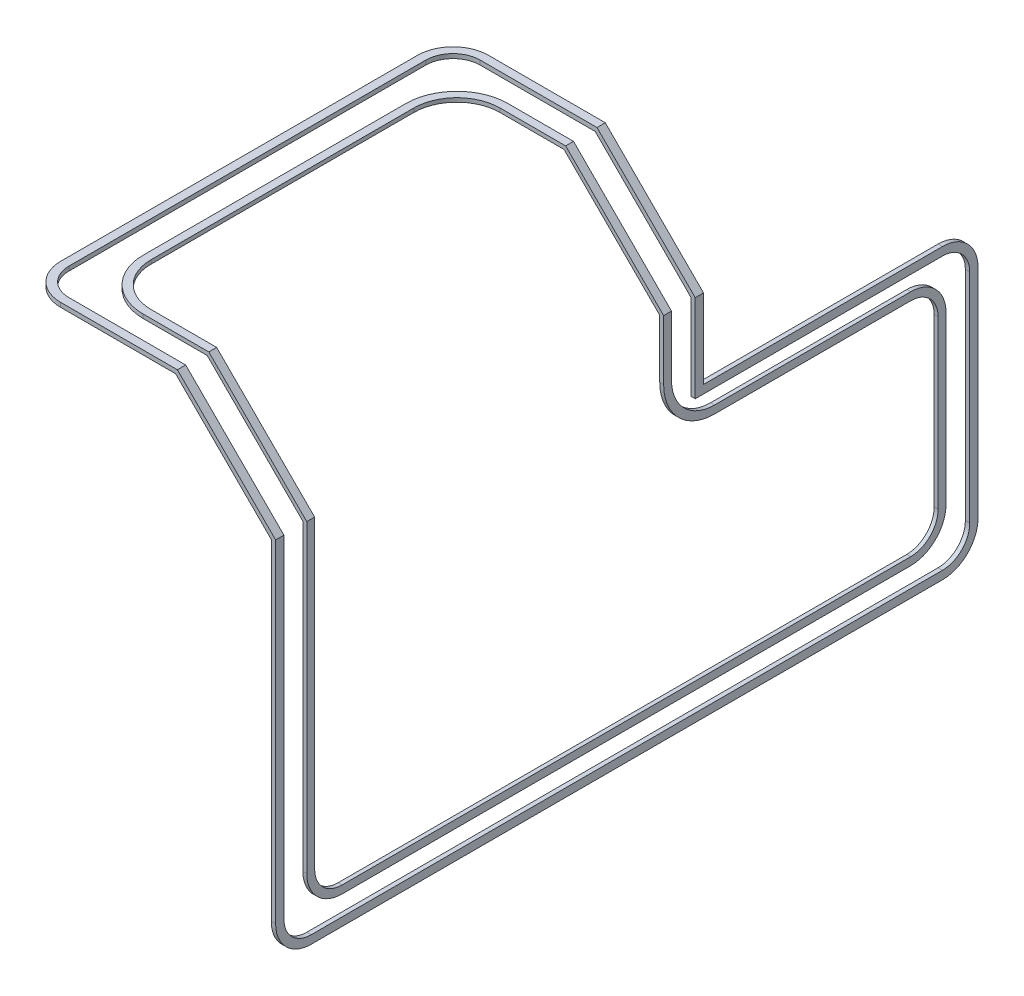
from build123d import *

# Parameters (mm, degrees)
SKETCH4_W = 6.7056
SKETCH4_H = 3.5306
SKETCH5_W = 3.175
SKETCH5_H = 6.35


with BuildPart() as part:
    # Sweep1: sweep along a curve in space
    with BuildLine() as sweep1_path:
        Line((141.986, 64.516, -11.1252), (141.986, -203.2, -11.1252))
        ThreePointArc((141.986, -203.2, -11.1252), (141.986, -221.160512242, -18.564687758), (141.986, -228.6, -36.5252))
        Line((141.986, -228.6, -36.5252), (141.986, -228.6, -547.6748))
        ThreePointArc((141.986, -228.6, -547.6748), (141.986, -221.160512242, -565.635312242), (141.986, -203.2, -573.0748))
        Line((141.986, -203.2, -573.0748), (141.986, -26.9875, -573.0748))
        ThreePointArc((141.986, -26.9875, -573.0748), (141.986, -9.026987758, -565.635312242), (141.986, -1.5875, -547.6748))
        Line((141.986, -1.5875, -547.6748), (141.986, -1.5875, -350.8502))
        Line((141.986, -1.5875, -350.8502), (141.986, 64.516, -350.8502))
        Line((64.516, 141.986, -350.8502), (141.986, 64.516, -350.8502))
        Line((-28.575, 141.986, -350.8502), (64.516, 141.986, -350.8502))
        ThreePointArc((-53.975, 141.986, -325.4502), (-46.535512242, 141.986, -343.410712242), (-28.575, 141.986, -350.8502))
        Line((-53.975, 141.986, -36.5252), (-53.975, 141.986, -325.4502))
        ThreePointArc((-28.575, 141.986, -11.1252), (-46.535512242, 141.986, -18.564687758), (-53.975, 141.986, -36.5252))
        Line((64.516, 141.986, -11.1252), (-28.575, 141.986, -11.1252))
        Line((64.516, 141.986, -11.1252), (141.986, 64.516, -11.1252))
    # Sketch4 → Sweep1 (sweep)
    with BuildSketch(Plane(origin=(0, 0, 0), x_dir=(0, 0, -1), z_dir=(0, 1, 0))):
        with Locations((11.1252, -143.7513)):
            Rectangle(SKETCH4_W, SKETCH4_H)
    sweep(path=sweep1_path.line, transition=Transition.RIGHT)


with BuildPart() as body_2:
    # Sweep2: sweep along a curve in space
    with BuildLine() as sweep2_path:
        Line((141.986, 64.516, -36.5252), (141.986, -180.975, -36.5252))
        ThreePointArc((141.986, -180.975, -36.5252), (141.986, -198.935512242, -43.964687758), (141.986, -206.375, -61.9252))
        Line((141.986, -206.375, -61.9252), (141.986, -206.375, -522.2748))
        ThreePointArc((141.986, -206.375, -522.2748), (141.986, -198.935512242, -540.235312242), (141.986, -180.975, -547.6748))
        Line((141.986, -180.975, -547.6748), (141.986, -46.0375, -547.6748))
        ThreePointArc((141.986, -46.0375, -547.6748), (141.986, -28.076987758, -540.235312242), (141.986, -20.6375, -522.2748))
        Line((141.986, -20.6375, -522.2748), (141.986, -20.6375, -363.5502))
        ThreePointArc((141.986, -20.6375, -363.5502), (141.986, -9.478268363, -336.609431637), (141.986, 17.4625, -325.4502))
        Line((141.986, 64.516, -325.4502), (141.986, 17.4625, -325.4502))
        Line((64.516, 141.986, -325.4502), (141.986, 64.516, -325.4502))
        Line((12.7, 141.986, -325.4502), (64.516, 141.986, -325.4502))
        ThreePointArc((-25.4, 141.986, -287.3502), (-14.240768363, 141.986, -314.290968363), (12.7, 141.986, -325.4502))
        Line((-25.4, 141.986, -74.6252), (-25.4, 141.986, -287.3502))
        ThreePointArc((12.7, 141.986, -36.5252), (-14.240768363, 141.986, -47.684431637), (-25.4, 141.986, -74.6252))
        Line((64.516, 141.986, -36.5252), (12.7, 141.986, -36.5252))
        Line((64.516, 141.986, -36.5252), (141.986, 64.516, -36.5252))
    # Sketch5 → Sweep2 (sweep)
    with BuildSketch(Plane(origin=(0, 0, 0), x_dir=(1, 0, 0), z_dir=(0, 1, 0))):
        with Locations((143.5735, 36.5252)):
            Rectangle(SKETCH5_W, SKETCH5_H)
    sweep(path=sweep2_path.line, transition=Transition.RIGHT)


solid = Compound([part.part, body_2.part])
